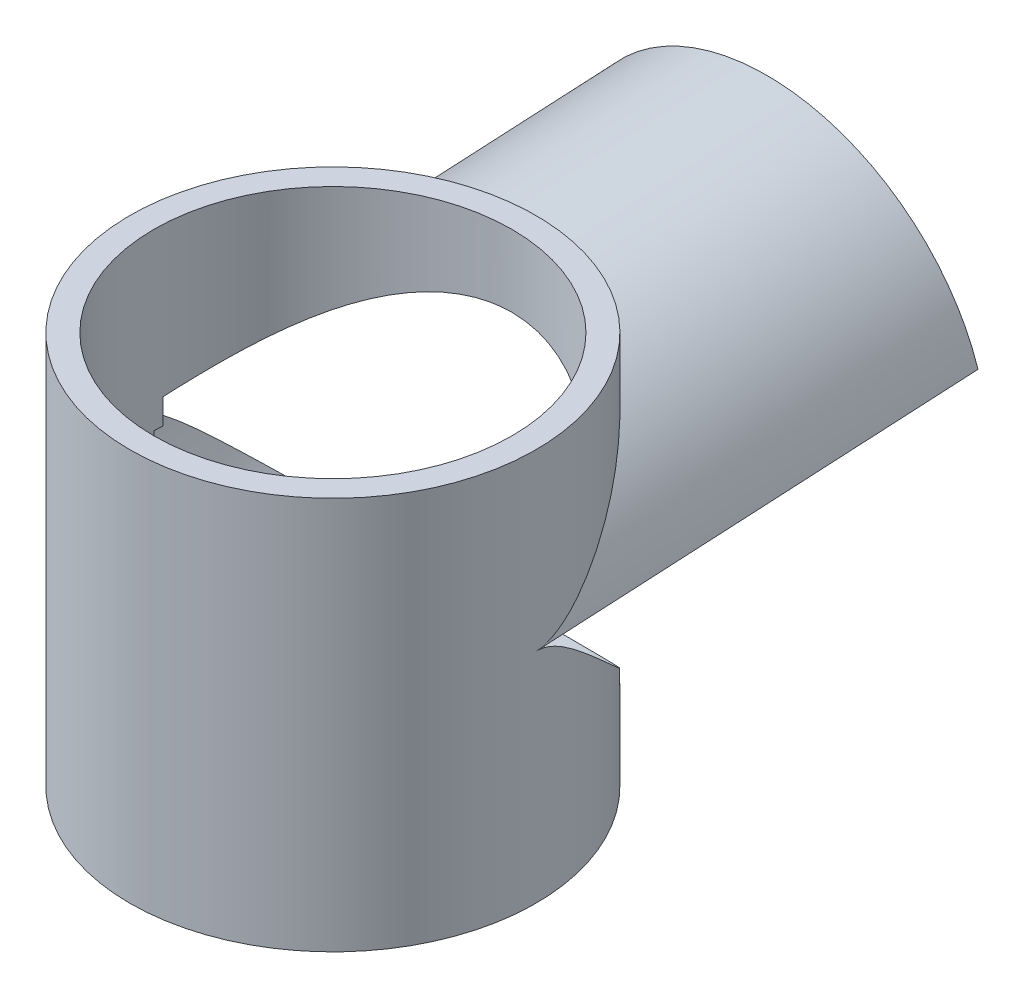
from build123d import *

# Parameters (mm, degrees)
SKETCH1_R                        = 23.25
SKETCH1_R_2                      = 20.5
BOSS_EXTRUDE1_DEPTH              = 40
BOSS_EXTRUDE2_START              = -5
SKETCH1_2_R                      = 23.25
BOSS_EXTRUDE2_DEPTH              = 5
CUT_EXTRUDE1_DEPTH               = 35
BOSS_EXTRUDE3_REACH              = 88.878
CUT_EXTRUDE5_REACH               = 90.17
CUT_EXTRUDE5_OFFSET_FROM_SURFACE = 1
SKETCH5_R                        = 1.25
CUT_EXTRUDE6_DEPTH               = 10


with BuildPart() as part:
    # Sketch1 → Boss-Extrude1 (new body)
    with BuildSketch(Plane(origin=(0, 0, 0), x_dir=(1, 0, 0), z_dir=(0, 1, 0))):
        Circle(SKETCH1_R)
        Circle(SKETCH1_R_2, mode=Mode.SUBTRACT)
    extrude(amount=BOSS_EXTRUDE1_DEPTH)

    # Sketch1<2> → Boss-Extrude2 (add)
    with BuildSketch(Plane(origin=(0, 0, 0), x_dir=(1, 0, 0), z_dir=(0, 1, 0)).offset(BOSS_EXTRUDE2_START)):
        Circle(SKETCH1_2_R)
    extrude(amount=BOSS_EXTRUDE2_DEPTH)

    # Sketch2 → Cut-Extrude1 (cut)
    with BuildSketch(Plane.XY):
        with BuildLine():
            ThreePointArc((-23.25, 20), (0, 0), (23.25, 20))
            Line((23.25, 20), (-23.25, 20))
        make_face()
    extrude(amount=-CUT_EXTRUDE1_DEPTH, mode=Mode.SUBTRACT)

    # Sketch3 → Boss-Extrude3 (add, up to next)
    with BuildSketch(Plane(origin=(0, 2.709163228, -51.693913872), x_dir=(1, 0, 0), z_dir=(0, -0.05233595624294392, 0.998629534754574)), mode=Mode.PRIVATE) as boss_extrude3_sk1:
        with BuildLine():
            ThreePointArc((23.25, 19.972590695), (0, 38.019650245), (-23.25, 19.972590695))
            ThreePointArc((-23.25, 19.972590695), (0, 30.650723957), (23.25, 19.972590695))
        make_face()
    boss_extrude3_tool1 = extrude(boss_extrude3_sk1.sketch, amount=BOSS_EXTRUDE3_REACH, mode=Mode.PRIVATE) - part.part
    add(boss_extrude3_tool1.solids().sort_by_distance((0, 34.101155, -50.048729))[0])

    # Cut-Extrude5: up to this face of the body (flat: up to its plane, moved by the offset)
    cut_extrude5_end = Plane(part.part.faces().sort_by_distance((-21.516068689, 17.104184879, 0))[0]).offset(CUT_EXTRUDE5_OFFSET_FROM_SURFACE)
    # Sketch4 → Cut-Extrude5 (cut, up to the picked face)
    with BuildSketch(Plane(origin=(0, 2.709163228, -51.693913872), x_dir=(1, 0, 0), z_dir=(0, -0.05233595624294392, 0.998629534754574)), mode=Mode.PRIVATE) as cut_extrude5_sk1:
        with BuildLine():
            add(Edge.make_bspline(
                [(-23.25, 19.972590695), (-23.25, 18.755779712), (0, 18.755779712), (23.25, 18.755779712), (23.25, 19.972590695)],
                knots=[3.141592654, 3.141592654, 3.141592654, 4.71238898, 4.71238898, 6.283185307, 6.283185307, 6.283185307], degree=2, weights=[1, 0.707106781, 1, 0.707106781, 1]))
            ThreePointArc((23.25, 19.972590695), (0, 30.650723957), (-23.25, 19.972590695))
        make_face()
    cut_extrude5_tool1 = split(extrude(cut_extrude5_sk1.sketch, amount=CUT_EXTRUDE5_REACH, mode=Mode.PRIVATE), bisect_by=cut_extrude5_end, keep=Keep.BOTH, mode=Mode.PRIVATE)
    add(cut_extrude5_tool1.solids().sort_by(Axis((0, 26.436495, -50.450417), (0, -0.05233595624294392, 0.998629534754574)))[0], mode=Mode.SUBTRACT)

    # Sketch5 → Cut-Extrude6 (cut)
    with BuildSketch(Plane(origin=(0, 0, 0), x_dir=(1, 0, 0), z_dir=(0, 1, 0))):
        Circle(SKETCH5_R)
    extrude(amount=-CUT_EXTRUDE6_DEPTH, mode=Mode.SUBTRACT)


solid = part.part
